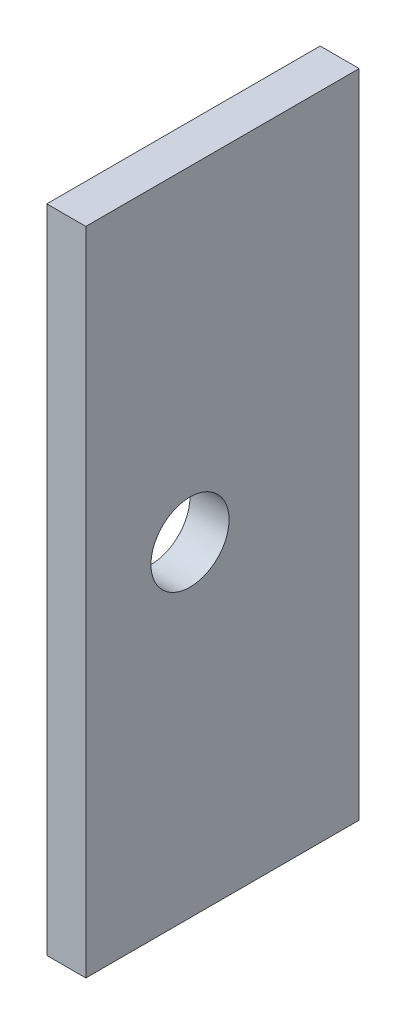
from build123d import *

# Parameters (mm, degrees)
SKETCH1_W                  = 2.1
SKETCH1_H                  = 5
BOSS_EXTRUDE1_DEPTH        = 0.3
F_0_6_0_6_DIAMETER_HOLE1_D = 0.6


with BuildPart() as part:
    # Sketch1 → Boss-Extrude1 (new body)
    with BuildSketch(Plane(origin=(0, 0, 0), x_dir=(0, 0, -1), z_dir=(1, 0, 0))):
        with Locations((1.05, 2.5)):
            Rectangle(SKETCH1_W, SKETCH1_H)
    extrude(amount=BOSS_EXTRUDE1_DEPTH)

    # Ø0.6 (0.6) Diameter Hole1 (through all)
    with Locations(Plane(origin=(0.3, 0, 0), x_dir=(0, 0, -1), z_dir=(1, 0, 0))):
        with Locations((0.8, 2.5)):
            Hole(F_0_6_0_6_DIAMETER_HOLE1_D / 2)


solid = part.part
